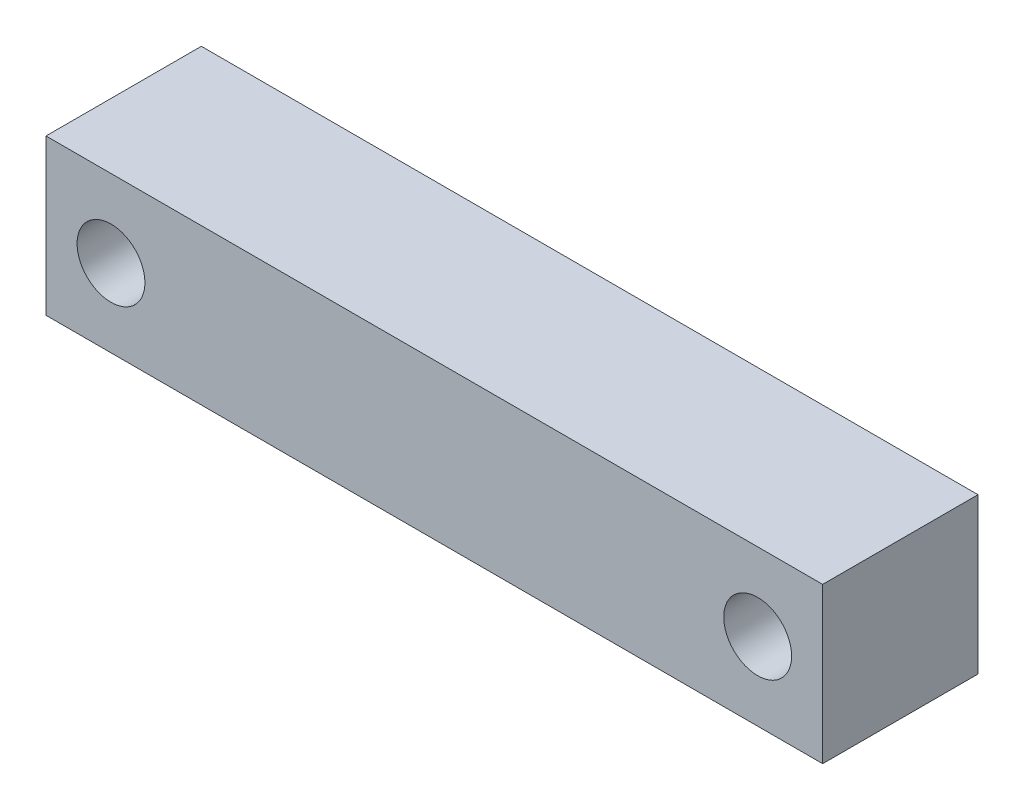
from build123d import *

# Parameters (mm, degrees)
SKETCH2_W                   = 25
SKETCH2_H                   = 5
BOSS_EXTRUDE1_DEPTH         = 5
F_44_0_086_DIAMETER_HOLE1_D = 2.1844
SKETCH5_W                   = 24
SKETCH5_H                   = 3
CUT_EXTRUDE1_DEPTH          = 3


with BuildPart() as part:
    # Sketch2 → Boss-Extrude1 (new body)
    with BuildSketch(Plane.XY):
        Rectangle(SKETCH2_W, SKETCH2_H)
    extrude(amount=BOSS_EXTRUDE1_DEPTH)

    # #44 (0.086) Diameter Hole1 (through all)
    with Locations(Plane(origin=(-10.4078, 0, 5), x_dir=(1, 0, 0), z_dir=(0, 0, 1))):
        with Locations((0, 0), (20.8156, 0)):
            Hole(F_44_0_086_DIAMETER_HOLE1_D / 2)

    # Sketch5 → Cut-Extrude1 (cut)
    with BuildSketch(Plane(origin=(0, 0, 0), x_dir=(-1, 0, 0), z_dir=(0, 0, -1))):
        with Locations((0.5, 0)):
            Rectangle(SKETCH5_W, SKETCH5_H)
    extrude(amount=-CUT_EXTRUDE1_DEPTH, mode=Mode.SUBTRACT)


solid = part.part
